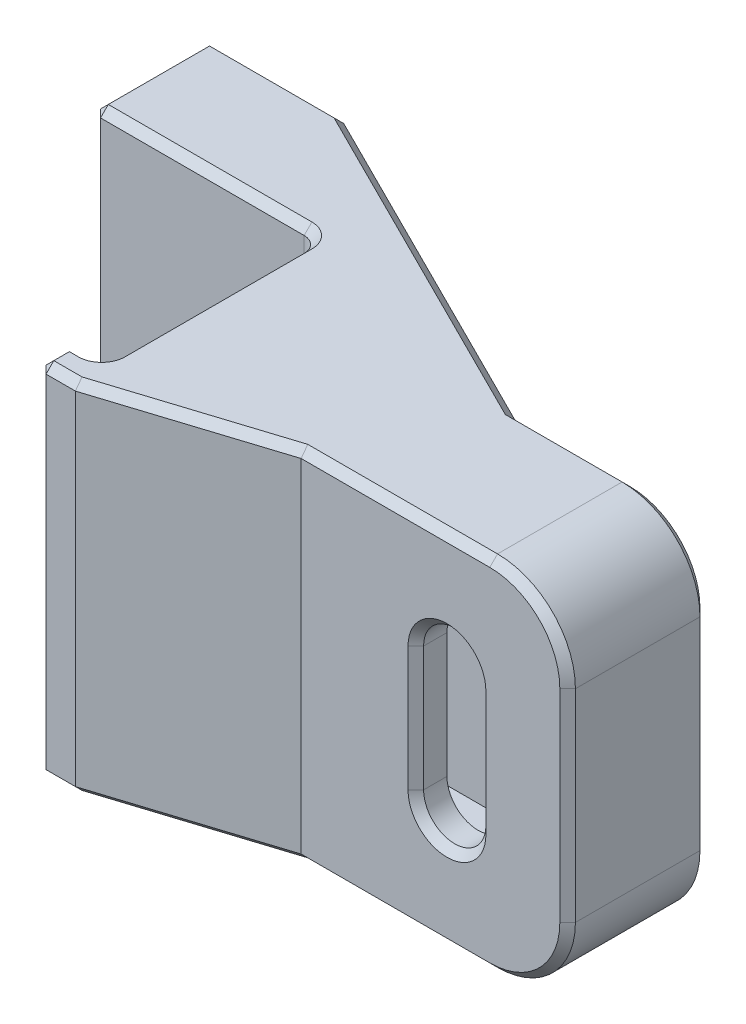
from build123d import *

# Parameters (mm, degrees)
CREATE_INTERNAL_GEOMETRY_DEPTH = 38
CUT_SHACKLE_HOLE_DEPTH         = 83.24962006
CAP_TOP_END_DEPTH              = 4
ROUND_CORNERS_R                = 10
UNNECESSARY_CHAMFERS_SIZE      = 1


with BuildPart() as part:
    # Sketch2 → Create internal geometry (new body)
    with BuildSketch(Plane(origin=(0, 0, 0), x_dir=(1, 0, 0), z_dir=(0, 1, 0))):
        Polygon((36.236067977, 20), (-7.763932023, 42), (-25, 42), (-25, 27), (4.236067977, 27), (26.236067977, 16), (57, 16), (57, 6), (26.155256109, 6), (4.155256109, -1), (0, -1), (0, -5), (4.776280544, -5), (26.776280544, 2), (61, 2), (61, 20), align=None)
    extrude(amount=CREATE_INTERNAL_GEOMETRY_DEPTH)

    # Sketch4 → Cut shackle hole (cut, through all)
    with BuildSketch(Plane.XY.offset(-2)):
        with BuildLine():
            Line((49.5, 27), (49.5, 11))
            ThreePointArc((49.5, 11), (45.5, 7), (41.5, 11))
            Line((41.5, 11), (41.5, 27))
            ThreePointArc((41.5, 27), (45.5, 31), (49.5, 27))
        make_face()
    extrude(amount=-CUT_SHACKLE_HOLE_DEPTH, mode=Mode.SUBTRACT)

    # Sketch3 → Cap top end (add)
    with BuildSketch(Plane(origin=(0, 38, 0), x_dir=(1, 0, 0), z_dir=(0, 1, 0))):
        with BuildLine():
            Line((-25, 27), (2.155256109, 27))
            ThreePointArc((2.155256109, 27), (3.569469671, 26.414213562), (4.155256109, 25))
            Line((4.155256109, 25), (4.155256109, 1))
            ThreePointArc((4.155256109, 1), (3.569469671, -0.414213562), (2.155256109, -1))
            Line((2.155256109, -1), (0, -1))
            Line((0, -1), (0, -5))
            Line((0, -5), (4.776280544, -5))
            Line((4.776280544, -5), (26.776280544, 2))
            Line((26.776280544, 2), (61, 2))
            Line((61, 2), (61, 20))
            Line((61, 20), (36.236067977, 20))
            Line((36.236067977, 20), (-7.763932023, 42))
            Line((-7.763932023, 42), (-25, 42))
            Line((-25, 42), (-25, 27))
        make_face()
    cap_top_end = extrude(amount=CAP_TOP_END_DEPTH)

    # Mirror top cap to bottom: Cap top end across plane
    add(cap_top_end.mirror(Plane.ZX.offset(19)))

    # Round corners
    round_corners_edges = [part.edges().sort_by_distance(p)[0] for p in [
        (61, -4, -11),
        (57, 0, -11),
        (57, 38, -11),
        (61, 42, -11),
    ]]
    fillet(round_corners_edges, radius=ROUND_CORNERS_R)

    # Unnecessary chamfers
    unnecessary_chamfers_edges = [part.edges().sort_by_distance(p)[0] for p in [
        (-25, -4, -34.5),
        (-16.381966011, -4, -42),
        (14.236067977, -4, -31),
        (38.888140272, -4, -2),
        (15.776280544, -4, 1.5),
        (2.388140272, -4, 5),
        (0, -4, 3),
        (1.077628054, -4, 1),
        (3.569469671, -4, 0.414213562),
        (4.155256109, -4, -13),
        (3.569469671, -4, -26.414213562),
        (-11.422371946, -4, -27),
        (43.618033989, 42, -20),
        (61, 19, -20),
        (43.618033989, -4, -20),
        (58.071067812, -1.071067812, -20),
        (58.071067812, 39.071067812, -20),
        (61, 19, -2),
        (58.071067812, -1.071067812, -2),
        (58.071067812, 39.071067812, -2),
        (0, 19, 1),
        (-25, 19, -27),
        (-25, 19, -42),
        (0, 19, 5),
        (45.5, 31, -20),
        (49.5, 19, -20),
        (45.5, 7, -20),
        (41.5, 19, -20),
        (45.5, 31, -2),
        (41.5, 19, -2),
        (45.5, 7, -2),
        (49.5, 19, -2),
        (-25, 42, -34.5),
        (-11.422371946, 42, -27),
        (3.569469671, 42, -26.414213562),
        (4.155256109, 42, -13),
        (3.569469671, 42, 0.414213562),
        (1.077628054, 42, 1),
        (0, 42, 3),
        (2.388140272, 42, 5),
        (15.776280544, 42, 1.5),
        (38.888140272, 42, -2),
        (14.236067977, 42, -31),
        (-16.381966011, 42, -42),
    ]]
    chamfer(unnecessary_chamfers_edges, length=UNNECESSARY_CHAMFERS_SIZE)


solid = part.part
